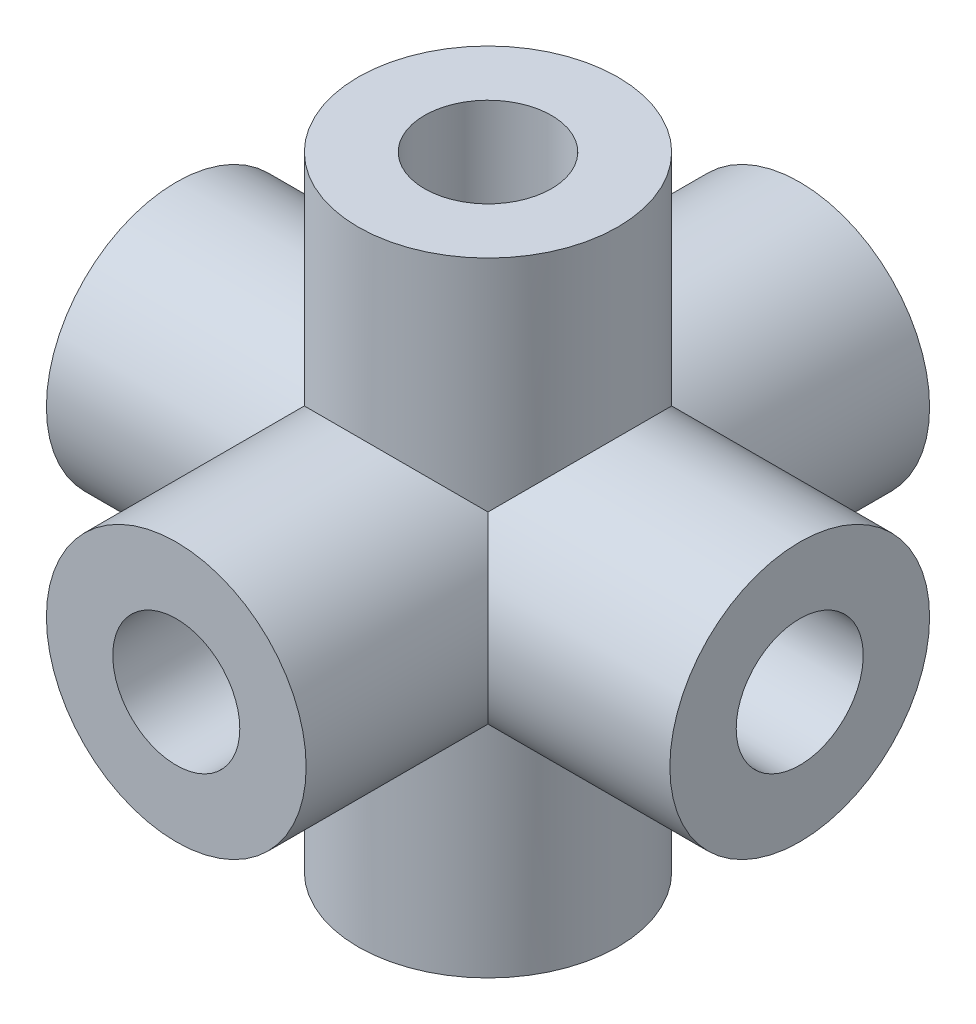
from build123d import *

# Parameters (mm, degrees)
IZIM1_R                     = 5
Y_KSEKLIK_EKSTR_ZYON1_DEPTH = 12
IZIM2_R                     = 5
Y_KSEKLIK_EKSTR_ZYON2_DEPTH = 12
IZIM3_R                     = 5
Y_KSEKLIK_EKSTR_ZYON3_DEPTH = 12
IZIM4_R                     = 2.445
KES_EKSTR_ZYON1_DEPTH       = 6
IZIM5_R                     = 2.445
KES_EKSTR_ZYON2_DEPTH       = 6
IZIM6_R                     = 2.445
KES_EKSTR_ZYON3_DEPTH       = 6


with BuildPart() as part:
    # Çizim1 → Yükseklik-Ekstrüzyon1 (new, symmetric)
    with BuildSketch(Plane.XY):
        Circle(IZIM1_R)
    extrude(amount=Y_KSEKLIK_EKSTR_ZYON1_DEPTH, both=True)

    # Çizim2 → Yükseklik-Ekstrüzyon2 (add, symmetric)
    with BuildSketch(Plane(origin=(0, 0, 0), x_dir=(1, 0, 0), z_dir=(0, 1, 0))):
        Circle(IZIM2_R)
    extrude(amount=Y_KSEKLIK_EKSTR_ZYON2_DEPTH, both=True)

    # Çizim3 → Yükseklik-Ekstrüzyon3 (add, symmetric)
    with BuildSketch(Plane(origin=(0, 0, 0), x_dir=(0, 0, -1), z_dir=(1, 0, 0))):
        with Locations(Location((0, 0, 0), (0, 0, 225))):
            Circle(IZIM3_R)
    extrude(amount=Y_KSEKLIK_EKSTR_ZYON3_DEPTH, both=True)

    # Çizim4 → Kes-Ekstrüzyon1 (cut)
    with BuildSketch(Plane.ZY.offset(12)):
        Circle(IZIM4_R)
    kes_ekstr_zyon1 = extrude(amount=-KES_EKSTR_ZYON1_DEPTH, mode=Mode.SUBTRACT)

    # Aynalama1: Kes-Ekstrüzyon1 across plane
    add(kes_ekstr_zyon1.mirror(Plane(origin=(0, 0, 0), x_dir=(0, 0, 1), z_dir=(1, 0, 0))), mode=Mode.SUBTRACT)

    # Çizim5 → Kes-Ekstrüzyon2 (cut)
    with BuildSketch(Plane.XY.offset(12)):
        Circle(IZIM5_R)
    kes_ekstr_zyon2 = extrude(amount=-KES_EKSTR_ZYON2_DEPTH, mode=Mode.SUBTRACT)

    # Aynalama2: Kes-Ekstrüzyon2 across plane
    add(kes_ekstr_zyon2.mirror(Plane.XY), mode=Mode.SUBTRACT)

    # Çizim6 → Kes-Ekstrüzyon3 (cut)
    with BuildSketch(Plane(origin=(0, 12, 0), x_dir=(1, 0, 0), z_dir=(0, 1, 0))):
        with Locations(Location((0, 0, 0), (0, 0, 270))):
            Circle(IZIM6_R)
    kes_ekstr_zyon3 = extrude(amount=-KES_EKSTR_ZYON3_DEPTH, mode=Mode.SUBTRACT)

    # Aynalama3: Kes-Ekstrüzyon3 across plane
    add(kes_ekstr_zyon3.mirror(Plane.ZX), mode=Mode.SUBTRACT)


solid = part.part
